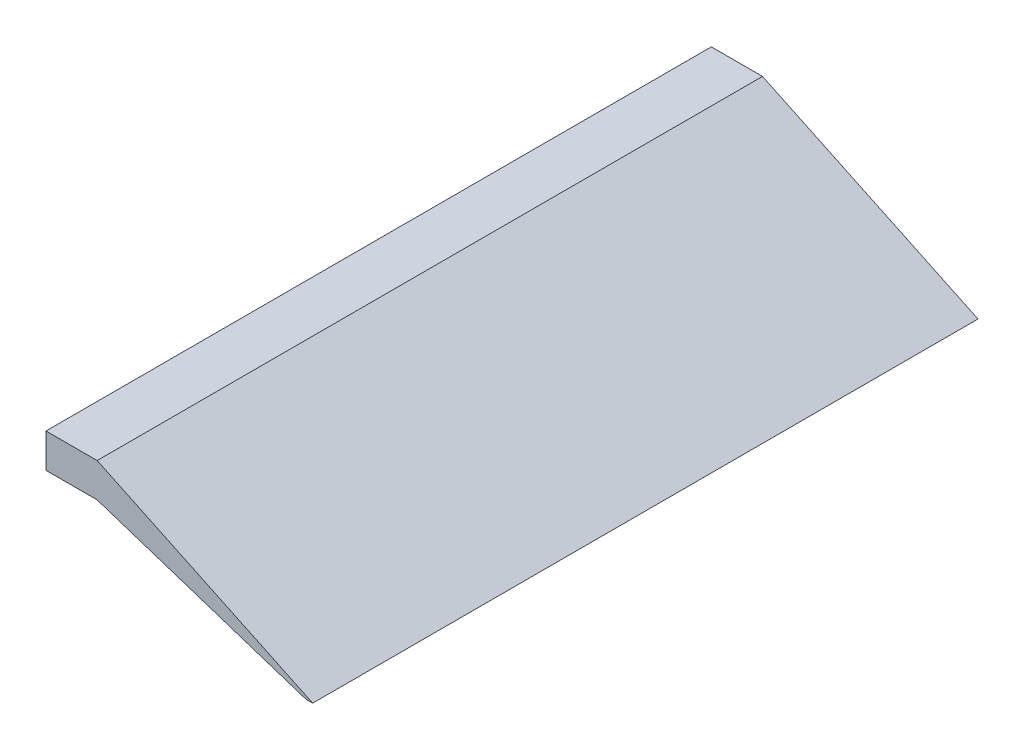
from build123d import *

# Parameters (mm, degrees)
SKETCH3_W           = 195
SKETCH3_H           = 10
BOSS_EXTRUDE1_DEPTH = 15
BOSS_EXTRUDE2_DEPTH = 97.5


with BuildPart() as part:
    # Sketch3 → Boss-Extrude1 (new body)
    with BuildSketch(Plane(origin=(0, 0, 0), x_dir=(0, 0, -1), z_dir=(1, 0, 0))):
        with Locations((0, 5)):
            Rectangle(SKETCH3_W, SKETCH3_H)
    extrude(amount=-BOSS_EXTRUDE1_DEPTH)

    # Sketch4 → Boss-Extrude2 (add, symmetric)
    with BuildSketch(Plane.XY):
        Polygon((61.163603665, -20), (63.163603665, -20), (0, 10), (0, 0), align=None)
    extrude(amount=BOSS_EXTRUDE2_DEPTH, both=True)


solid = part.part
